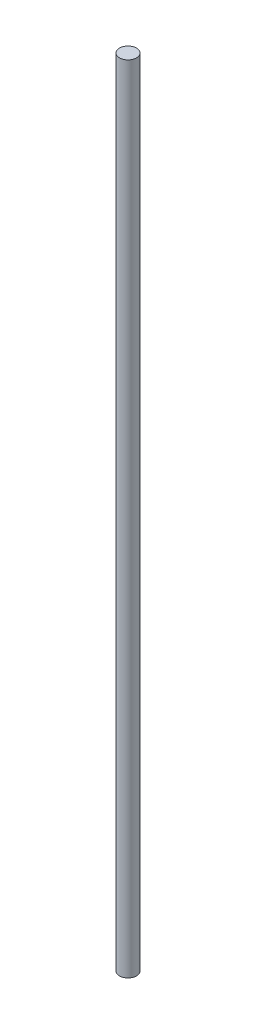
from build123d import *

# Parameters (mm, degrees)
SKETCH1_W = 1.5
SKETCH1_H = 140


with BuildPart() as part:
    # Sketch1 → Revolve1 (revolve)
    with BuildSketch(Plane.XY, mode=Mode.PRIVATE) as revolve1_sk:
        with Locations((0.75, 70)):
            Rectangle(SKETCH1_W, SKETCH1_H)
    revolve(revolve1_sk.sketch.rotate(Axis((0, 140, 0), (0, -1, 0)), 270), axis=Axis((0, 140, 0), (0, -1, 0)))


solid = part.part
